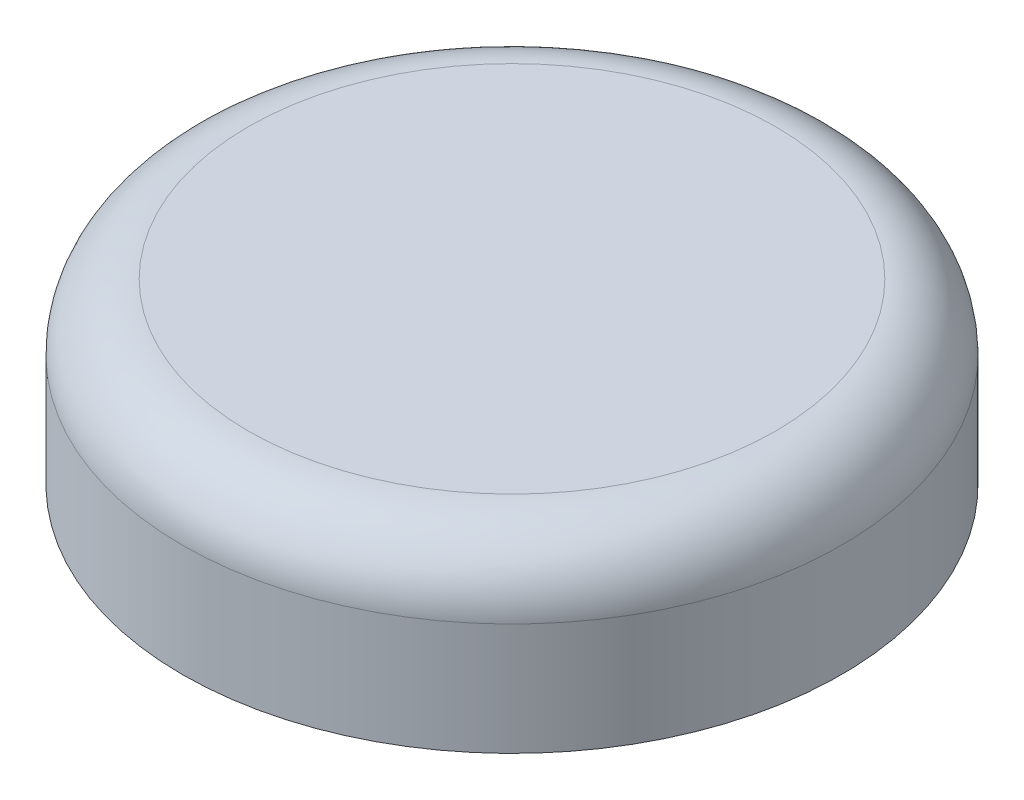
from build123d import *

# Parameters (mm, degrees)
ESQUISSE2_R        = 5
BOSS_EXTRU_1_DEPTH = 2.7
CONG_1_R           = 1


with BuildPart() as part:
    # Esquisse2 → Boss.-Extru.1 (new body)
    with BuildSketch(Plane(origin=(0, 0, 0), x_dir=(1, 0, 0), z_dir=(0, 1, 0))):
        with Locations(Location((0, 0, 0), (0, 0, 90))):
            Circle(ESQUISSE2_R)
    extrude(amount=BOSS_EXTRU_1_DEPTH)

    # Congé1
    cong_1_edges = [part.edges().sort_by_distance(p)[0] for p in [
        (0, 2.7, 5),
    ]]
    fillet(cong_1_edges, radius=CONG_1_R)


solid = part.part
